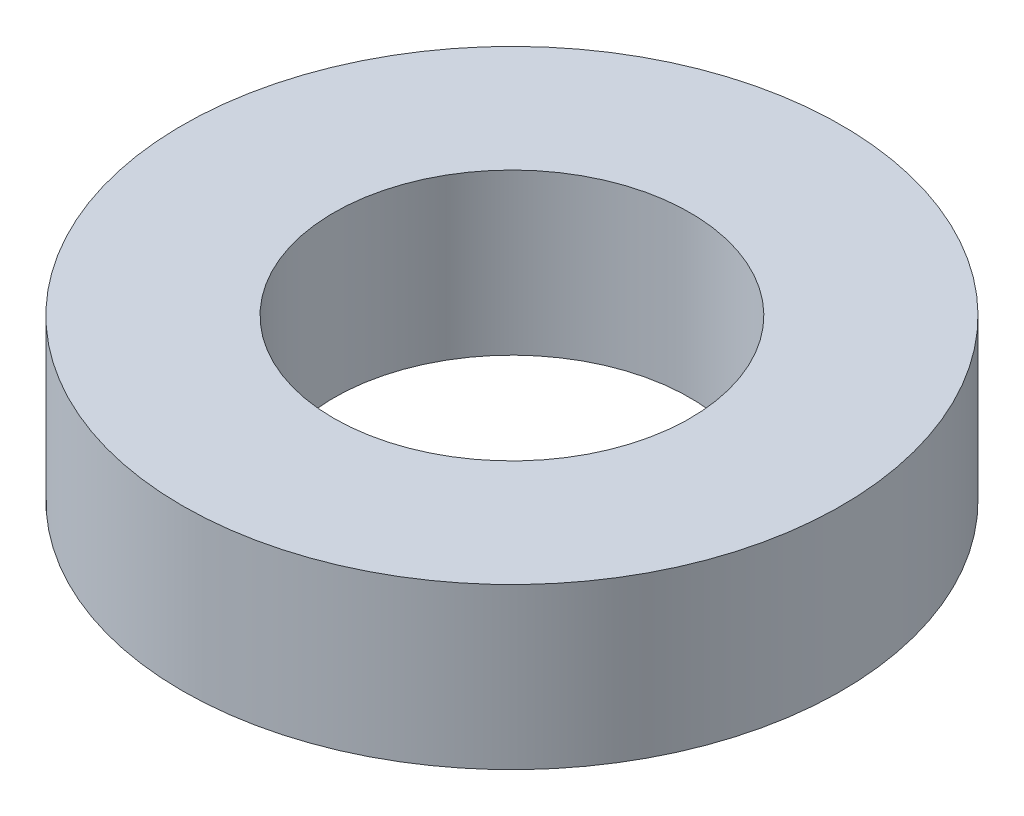
from build123d import *

# Parameters (mm, degrees)
ESQUISSE1_R             = 18.5
BOSS_EXTRU_1_DEPTH      = 9
ESQUISSE2_R             = 10
ENL_V_MAT_EXTRU_1_DEPTH = 9


with BuildPart() as part:
    # Esquisse1 → Boss.-Extru.1 (new body)
    with BuildSketch(Plane(origin=(0, 0, 0), x_dir=(1, 0, 0), z_dir=(0, 1, 0))):
        with Locations(Location((0, 0, 0), (0, 0, 270))):
            Circle(ESQUISSE1_R)
    extrude(amount=BOSS_EXTRU_1_DEPTH)

    # Esquisse2 → Enlèv. mat.-Extru.1 (cut)
    with BuildSketch(Plane(origin=(0, 9, 0), x_dir=(1, 0, 0), z_dir=(0, 1, 0))):
        with Locations(Location((0, 0, 0), (0, 0, 270))):
            Circle(ESQUISSE2_R)
    extrude(amount=-ENL_V_MAT_EXTRU_1_DEPTH, mode=Mode.SUBTRACT)


solid = part.part
